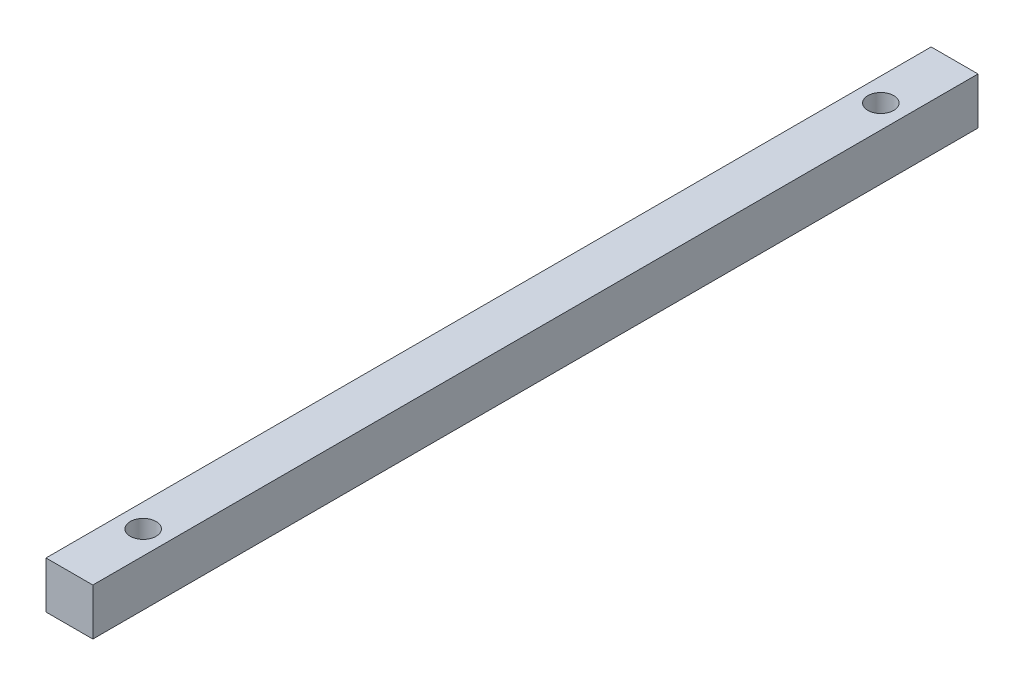
from build123d import *

# Parameters (mm, degrees)
BOSS_EXTRUDE1_DEPTH      = 609.6
BOSS_EXTRUDE1_DEPTH_BACK = 609.6
SKETCH3_W                = 6.35
SKETCH3_H                = 6.35
SKETCH4_W                = 7.35
SKETCH4_H                = 7.35
CUT_EXTRUDE1_DEPTH       = 1100.209170836
SKETCH5_R                = 1.75
CUT_EXTRUDE2_DEPTH       = 610.641339744


with BuildPart() as part:
    # Sketch3 → Boss-Extrude1 (new, two sides: drawn at the far end of the back side and taken through both)
    with BuildSketch(Plane.XY.offset(-BOSS_EXTRUDE1_DEPTH_BACK)):
        Rectangle(SKETCH3_W, SKETCH3_H)
    extrude(amount=BOSS_EXTRUDE1_DEPTH + BOSS_EXTRUDE1_DEPTH_BACK)

    # Sketch4 → Cut-Extrude1 (cut, through all)
    with BuildSketch(Plane(origin=(0, 0, -489.6), x_dir=(-1, 0, 0), z_dir=(0, 0, -1))):
        Rectangle(SKETCH4_W, SKETCH4_H)
    extrude(amount=-CUT_EXTRUDE1_DEPTH, mode=Mode.SUBTRACT)

    # Sketch5 → Cut-Extrude2 (cut, through all)
    with BuildSketch(Plane(origin=(0, 3.175, 0), x_dir=(1, 0, 0), z_dir=(0, 1, 0))):
        with Locations(Location((0, 599.6, 0), (0, 0, 270))):
            Circle(SKETCH5_R)
        with Locations(Location((0, 499.6, 0), (0, 0, 270))):
            Circle(SKETCH5_R)
    extrude(amount=-CUT_EXTRUDE2_DEPTH, mode=Mode.SUBTRACT)


solid = part.part
